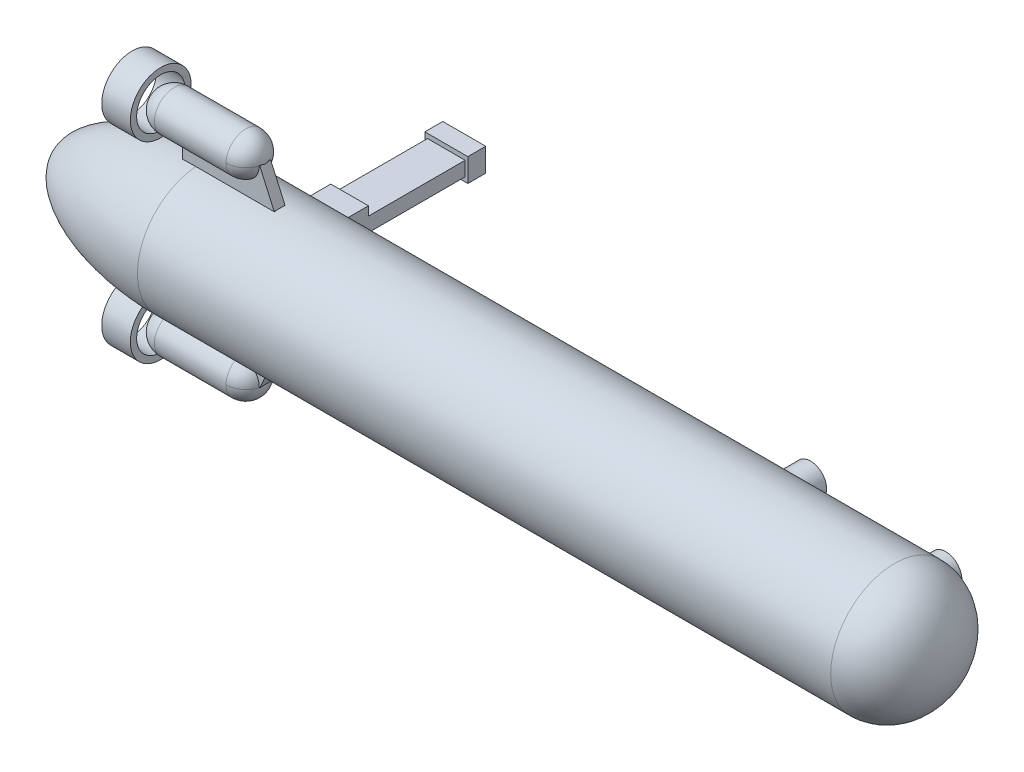
from build123d import *

# Parameters (mm, degrees)
SKETCH1_R                = 115
BOSS_EXTRUDE2_DEPTH      = 761.29
BOSS_EXTRUDE3_START      = -487.1
SKETCH2_R                = 115
BOSS_EXTRUDE3_DEPTH      = 487.1
SKETCH5_R                = 29
BOSS_EXTRUDE4_DEPTH      = 170
SKETCH6_R                = 29
BOSS_EXTRUDE5_DEPTH      = 150.5
SKETCH7_W                = 67.75
SKETCH7_H                = 58
BOSS_EXTRUDE6_DEPTH      = 170
SKETCH8_W                = 67.75
SKETCH8_H                = 25.8
BOSS_EXTRUDE7_DEPTH      = 174.2
SKETCH9_W                = 77.4
SKETCH9_H                = 42
BOSS_EXTRUDE8_DEPTH      = 32.26
BOSS_EXTRUDE9_DEPTH      = 9.75
BOSS_EXTRUDE9_DEPTH_BACK = 9.75
SKETCH11_R               = 35.5
BOSS_EXTRUDE10_DEPTH     = 129
SKETCH14_R               = 54.84
SKETCH14_R_2             = 43.5
BOSS_EXTRUDE11_DEPTH     = 51.5
BOSS_EXTRUDE11_2_DEPTH   = 51.5


with BuildPart() as part:
    # Sketch1 → Boss-Extrude2 (new body)
    with BuildSketch(Plane(origin=(0, 0, 0), x_dir=(0, 0, -1), z_dir=(1, 0, 0))):
        Circle(SKETCH1_R)
    extrude(amount=BOSS_EXTRUDE2_DEPTH)

    # Sketch2 → Boss-Extrude3 (add)
    with BuildSketch(Plane(origin=(0, 0, 0), x_dir=(0, 0, -1), z_dir=(1, 0, 0)).offset(BOSS_EXTRUDE3_START)):
        Circle(SKETCH2_R)
    extrude(amount=BOSS_EXTRUDE3_DEPTH)

    # Sketch3 → Revolve1 (revolve)
    with BuildSketch(Plane(origin=(0, 0, 0), x_dir=(1, 0, 0), z_dir=(0, 1, 0))):
        with BuildLine():
            Line((761.29, 0), (858.06, 0))
            add(Edge.make_bspline(
                [(858.06, 0), (858.06, 115), (761.29, 115)],
                knots=[4.71238898, 4.71238898, 4.71238898, 6.283185307, 6.283185307, 6.283185307], degree=2, weights=[1, 0.707106781, 1]))
            Line((761.29, 115), (761.29, 0))
        make_face()
    revolve(axis=Axis((761.29, 0, 0), (1, 0, 0)))

    # Sketch4 → Revolve2 (revolve)
    with BuildSketch(Plane(origin=(0, 0, 0), x_dir=(1, 0, 0), z_dir=(0, 1, 0))):
        with BuildLine():
            Line((-487.1, 0), (-741.94, 0))
            add(Edge.make_bspline(
                [(-741.94, 0), (-741.94, -115), (-487.1, -115)],
                knots=[0, 0, 0, 1.570796327, 1.570796327, 1.570796327], degree=2, weights=[1, 0.707106781, 1]))
            Line((-487.1, -115), (-487.1, 0))
        make_face()
    revolve(axis=Axis((858.06, 0, 0), (-1, 0, 0)))

    # Sketch5 → Boss-Extrude4 (add)
    with BuildSketch(Plane.XY):
        with Locations((440, 0)):
            Circle(SKETCH5_R)
    extrude(amount=-BOSS_EXTRUDE4_DEPTH)

    # Sketch6 → Boss-Extrude5 (add)
    with BuildSketch(Plane.XY):
        with Locations((703, 0)):
            Circle(SKETCH6_R)
    extrude(amount=-BOSS_EXTRUDE5_DEPTH)

    # Sketch7 → Boss-Extrude6 (add)
    with BuildSketch(Plane.XY):
        with Locations((-390, 0)):
            Rectangle(SKETCH7_W, SKETCH7_H)
    extrude(amount=-BOSS_EXTRUDE6_DEPTH)

    # Sketch8 → Boss-Extrude7 (add)
    with BuildSketch(Plane(origin=(0, 0, -170), x_dir=(-1, 0, 0), z_dir=(0, 0, -1))):
        with Locations((390, 0)):
            Rectangle(SKETCH8_W, SKETCH8_H)
    extrude(amount=BOSS_EXTRUDE7_DEPTH)

    # Sketch9 → Boss-Extrude8 (add)
    with BuildSketch(Plane(origin=(0, 0, -344.2), x_dir=(-1, 0, 0), z_dir=(0, 0, -1))):
        with Locations((390, 0)):
            Rectangle(SKETCH9_W, SKETCH9_H)
    extrude(amount=BOSS_EXTRUDE8_DEPTH)

    # Sketch10 → Boss-Extrude9 (add, two sides: drawn at the far end of the back side and taken through both)
    with BuildSketch(Plane.XY.offset(-BOSS_EXTRUDE9_DEPTH_BACK)):
        Polygon((-346, -115), (-346, 115), (-372, 173), (-511, 173), (-511, -173), (-372, -173), align=None)
    extrude(amount=BOSS_EXTRUDE9_DEPTH + BOSS_EXTRUDE9_DEPTH_BACK)

    # Sketch11 → Boss-Extrude10 (add)
    with BuildSketch(Plane(origin=(-407, 0, 0), x_dir=(0, 0, -1), z_dir=(1, 0, 0))):
        with Locations((0, 173)):
            Circle(SKETCH11_R)
        with Locations((0, -173)):
            Circle(SKETCH11_R)
    extrude(amount=-BOSS_EXTRUDE10_DEPTH)

    # Sketch12 → Revolve6 (revolve)
    with BuildSketch(Plane(origin=(0, 173, 0), x_dir=(1, 0, 0), z_dir=(0, 1, 0)), mode=Mode.PRIVATE) as revolve6_sk:
        with BuildLine():
            Line((-407, 35.5), (-407, 0))
            Line((-407, 0), (-371.5, 0))
            ThreePointArc((-371.5, 0), (-381.897709268, 25.102290732), (-407, 35.5))
        make_face()
        with BuildLine():
            Line((-536, 0), (-536, 35.5))
            ThreePointArc((-536, 35.5), (-561.102290732, 25.102290732), (-571.5, 0))
            Line((-571.5, 0), (-536, 0))
        make_face()
    revolve(revolve6_sk.sketch.rotate(Axis((-536, 173, 0), (1, 0, 0)), 180), axis=Axis((-536, 173, 0), (1, 0, 0)))

    # Sketch13 → Revolve7 (revolve)
    with BuildSketch(Plane(origin=(0, -173, 0), x_dir=(-1, 0, 0), z_dir=(0, -1, 0))):
        with BuildLine():
            Line((407, 0), (371.5, 0))
            ThreePointArc((371.5, 0), (381.897709268, -25.102290732), (407, -35.5))
            Line((407, -35.5), (407, 0))
        make_face()
        with BuildLine():
            Line((536, 0), (571.5, 0))
            ThreePointArc((571.5, 0), (561.102290732, -25.102290732), (536, -35.5))
            Line((536, -35.5), (536, 0))
        make_face()
    revolve(axis=Axis((-407, -173, 0), (1, 0, 0)))


with BuildPart() as body_2:
    # Sketch14 → Boss-Extrude11 (new body)
    with BuildSketch(Plane(origin=(-560, 0, 0), x_dir=(0, 0, -1), z_dir=(1, 0, 0))):
        with Locations((0, 173)):
            Circle(SKETCH14_R)
        with Locations((0, 173)):
            Circle(SKETCH14_R_2, mode=Mode.SUBTRACT)
    extrude(amount=-BOSS_EXTRUDE11_DEPTH)


with BuildPart() as body_3:
    # Sketch14 → Boss-Extrude11 2 (new body)
    with BuildSketch(Plane(origin=(-560, 0, 0), x_dir=(0, 0, -1), z_dir=(1, 0, 0))):
        with Locations((0, -173)):
            Circle(SKETCH14_R)
        with Locations((0, -173)):
            Circle(SKETCH14_R_2, mode=Mode.SUBTRACT)
    extrude(amount=-BOSS_EXTRUDE11_2_DEPTH)


solid = Compound([part.part, body_2.part, body_3.part])
